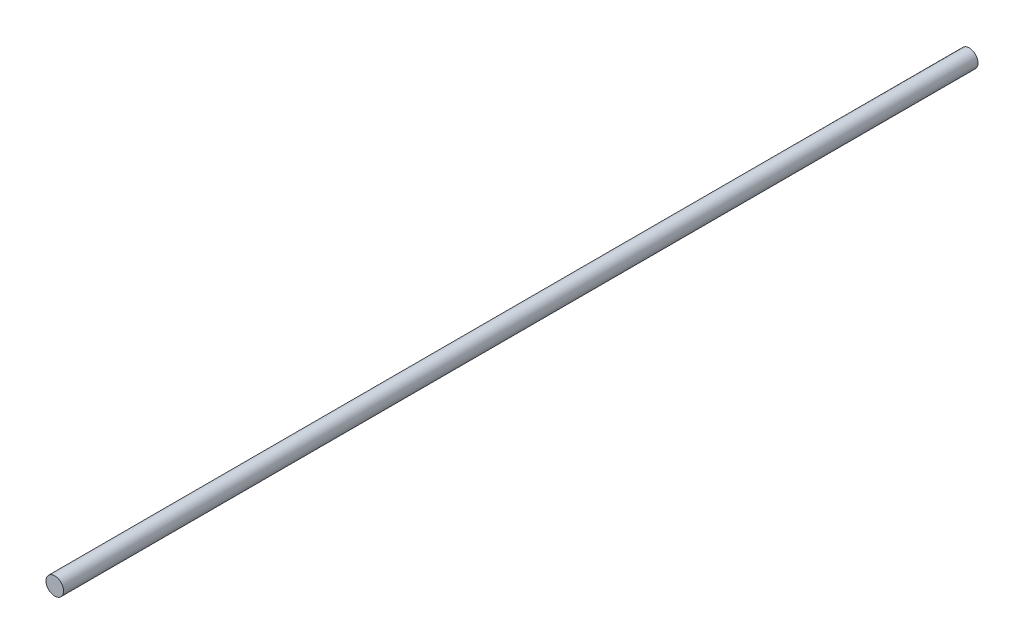
from build123d import *

# Parameters (mm, degrees)
SKETCH1_R           = 3.175
BOSS_EXTRUDE1_DEPTH = 330.2


with BuildPart() as part:
    # Sketch1 → Boss-Extrude1 (new body)
    with BuildSketch(Plane.XY):
        Circle(SKETCH1_R)
    extrude(amount=BOSS_EXTRUDE1_DEPTH)


solid = part.part
